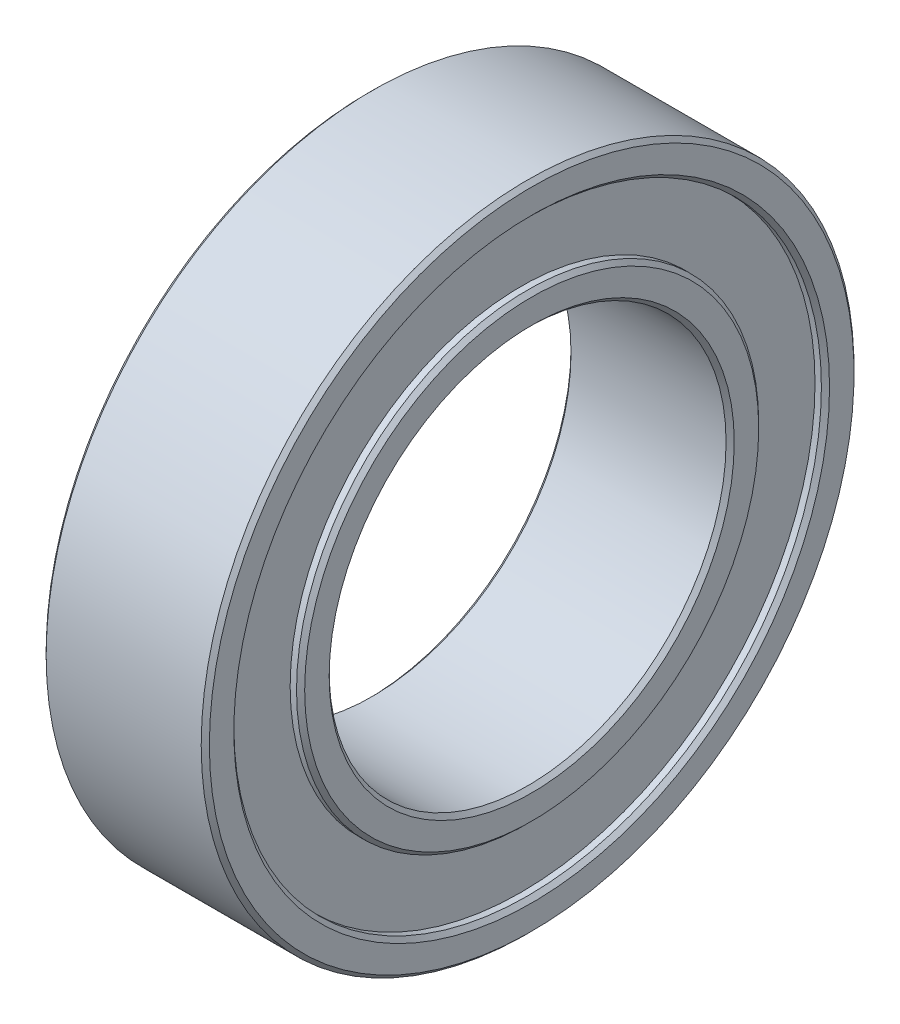
from build123d import *

# Parameters (mm, degrees)
SKETCH1_R             = 5.61975
SKETCH1_R_2           = 4.826
BOSS_EXTRUDE1_DEPTH   = 1.984375
SKETCH1_R_3           = 7.9375
SKETCH1_R_4           = 7.14375
BOSS_EXTRUDE1_2_DEPTH = 1.984375
SKETCH2_R             = 7.14375
SKETCH2_R_2           = 5.61975
BOSS_EXTRUDE2_DEPTH   = 1.730375
CHAMFER1_SIZE         = 0.09921875


with BuildPart() as part:
    # Sketch1 → Boss-Extrude1 (new, symmetric)
    with BuildSketch(Plane(origin=(0, 0, 0), x_dir=(0, 0, -1), z_dir=(1, 0, 0))):
        Circle(SKETCH1_R)
        Circle(SKETCH1_R_2, mode=Mode.SUBTRACT)
    extrude(amount=BOSS_EXTRUDE1_DEPTH, both=True)



with BuildPart() as body_2:
    # Sketch1 → Boss-Extrude1 2 (new, symmetric)
    with BuildSketch(Plane(origin=(0, 0, 0), x_dir=(0, 0, -1), z_dir=(1, 0, 0))):
        Circle(SKETCH1_R_3)
        Circle(SKETCH1_R_4, mode=Mode.SUBTRACT)
    extrude(amount=BOSS_EXTRUDE1_2_DEPTH, both=True)


with BuildPart() as part_1:
    add(part.part)

    add(body_2.part)  # Boss-Extrude2 merges body 2
    # Sketch2 → Boss-Extrude2 (add, symmetric)
    with BuildSketch(Plane(origin=(0, 0, 0), x_dir=(0, 0, -1), z_dir=(1, 0, 0))):
        Circle(SKETCH2_R)
        Circle(SKETCH2_R_2, mode=Mode.SUBTRACT)
    extrude(amount=BOSS_EXTRUDE2_DEPTH, both=True)

    # Chamfer1
    chamfer1_edges = [part_1.edges().sort_by_distance(p)[0] for p in [
        (1.984375, 0, 5.61975),
        (1.984375, 0, 7.14375),
        (-1.984375, 0, 7.9375),
        (1.984375, 0, 7.9375),
        (-1.984375, 0, 4.826),
        (1.984375, 0, 4.826),
    ]]
    chamfer(chamfer1_edges, length=CHAMFER1_SIZE)


solid = part_1.part
